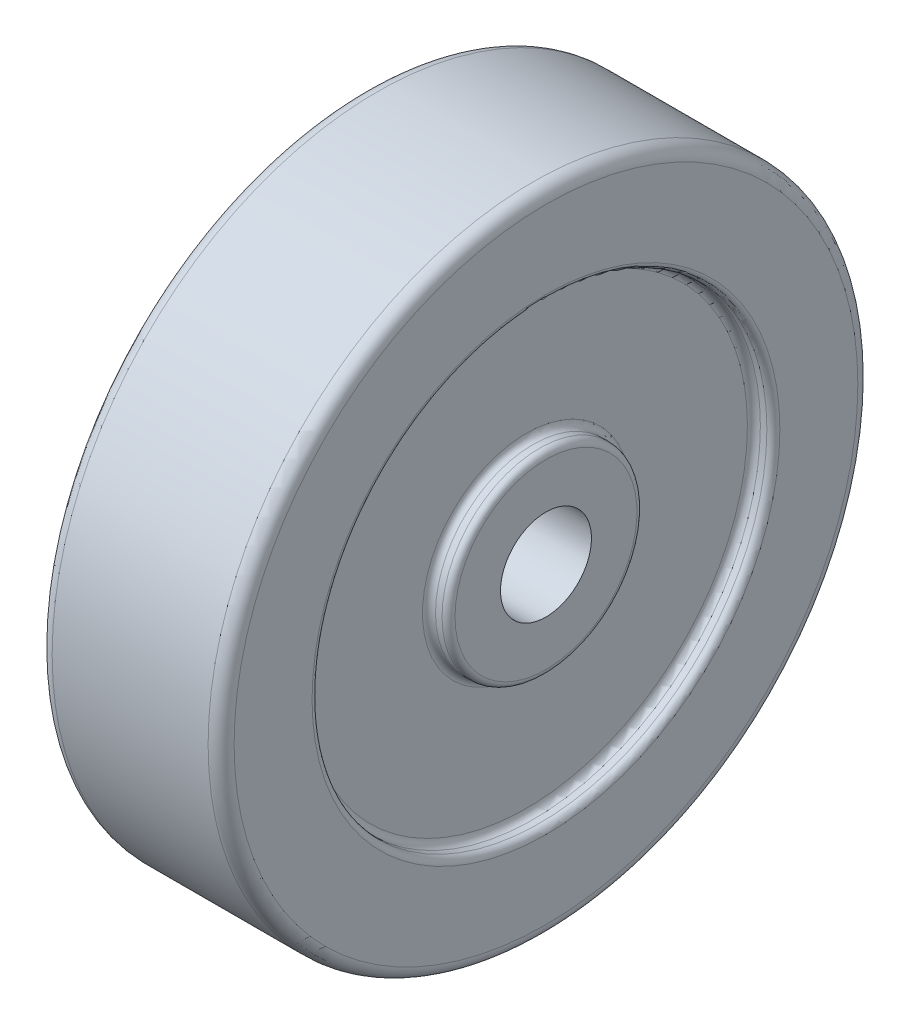
from build123d import *

# Parameters (mm, degrees)
SKETCH1_W       = 28
SKETCH1_H       = 8
SKETCH1_W_2     = 22
SKETCH1_H_2     = 20
SKETCH1_H_3     = 15
OUTER_FILLETS_R = 2
INNER_FILLETS_R = 1


with BuildPart() as part:
    # Sketch1 → Main Wheel Body (revolve)
    with BuildSketch(Plane.XY, mode=Mode.PRIVATE) as main_wheel_body_sk:
        with Locations((0, 11)):
            Rectangle(SKETCH1_W, SKETCH1_H)
        with Locations((0, 25)):
            Rectangle(SKETCH1_W_2, SKETCH1_H_2)
        with Locations((0, 42.5)):
            Rectangle(SKETCH1_W, SKETCH1_H_3)
    revolve(main_wheel_body_sk.sketch.rotate(Axis((-14, 0, 0), (1, 0, 0)), 90), axis=Axis((-14, 0, 0), (1, 0, 0)))

    # Outer Fillets
    outer_fillets_edges = [part.edges().sort_by_distance(p)[0] for p in [
        (-14, 0, -50),
        (14, 0, -50),
    ]]
    fillet(outer_fillets_edges, radius=OUTER_FILLETS_R)

    # Inner Fillets
    inner_fillets_edges = [part.edges().sort_by_distance(p)[0] for p in [
        (-11, 0, -15),
        (-11, 0, -35),
        (-14, 0, -35),
        (14, 0, -35),
        (11, 0, -35),
        (11, 0, -15),
        (14, 0, -15),
        (-14, 0, -15),
    ]]
    fillet(inner_fillets_edges, radius=INNER_FILLETS_R)


solid = part.part
